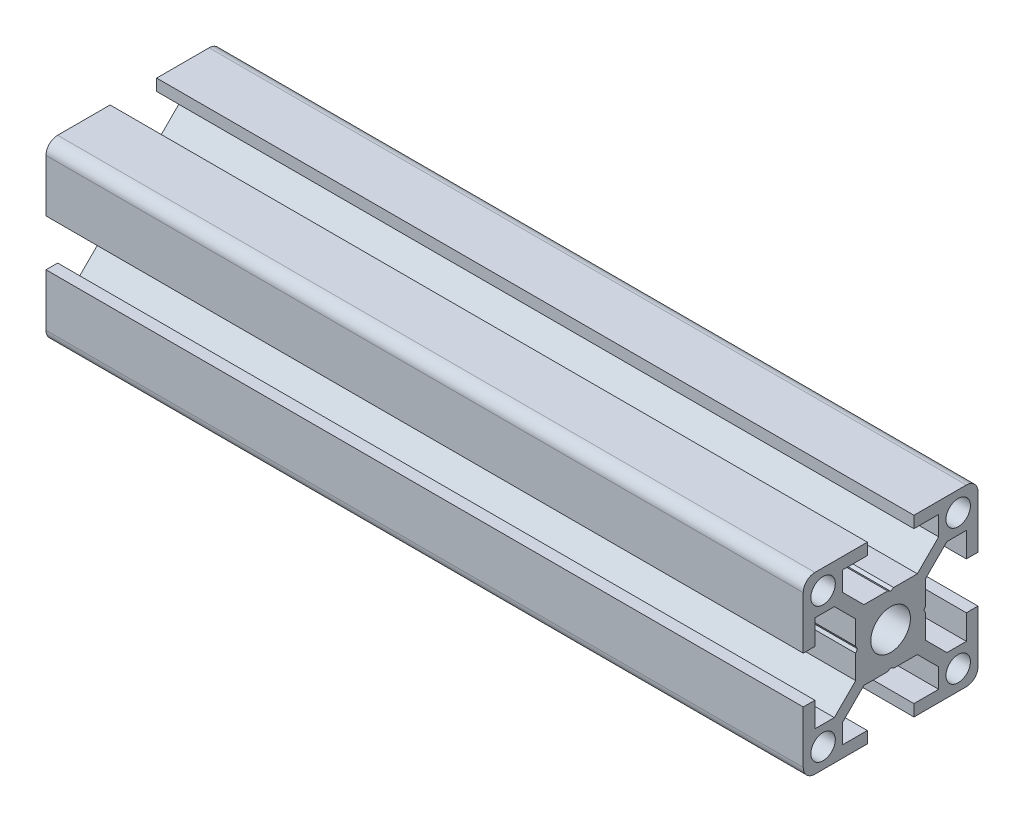
from build123d import *

# Parameters (mm, degrees)
SKETCH12_R              = 3.4
SKETCH12_R_2            = 2.1
NH_H_NH_30X30X2_1_DEPTH = 130


with BuildPart() as part:
    # Sketch12 → Ðnh hình 30X30X2(1) (new body)
    with BuildSketch(Plane.YZ):
        with BuildLine():
            Line((13, -4), (13, -8.25))
            Line((13, -8.25), (9.664213562, -8.25))
            Line((9.664213562, -8.25), (6, -4.585786438))
            Line((6, -4.585786438), (6, -0.519615242))
            Line((6, -0.519615242), (5.7, 0))
            Line((5.7, 0), (6, 0.519615242))
            Line((6, 0.519615242), (6, 4.585786438))
            Line((6, 4.585786438), (9.664213562, 8.25))
            Line((9.664213562, 8.25), (13, 8.25))
            Line((13, 8.25), (13, 4))
            Line((13, 4), (15, 4))
            Line((15, 4), (15, 13))
            ThreePointArc((15, 13), (14.414213562, 14.414213562), (13, 15))
            Line((13, 15), (4, 15))
            Line((4, 15), (4, 13))
            Line((4, 13), (8.25, 13))
            Line((8.25, 13), (8.25, 9.664213562))
            Line((8.25, 9.664213562), (4.585786438, 6))
            Line((4.585786438, 6), (0.519615242, 6))
            Line((0.519615242, 6), (0, 5.7))
            Line((0, 5.7), (-0.519615242, 6))
            Line((-0.519615242, 6), (-4.585786438, 6))
            Line((-4.585786438, 6), (-8.25, 9.664213562))
            Line((-8.25, 9.664213562), (-8.25, 13))
            Line((-8.25, 13), (-4, 13))
            Line((-4, 13), (-4, 15))
            Line((-4, 15), (-13, 15))
            ThreePointArc((-13, 15), (-14.414213562, 14.414213562), (-15, 13))
            Line((-15, 13), (-15, 4))
            Line((-15, 4), (-13, 4))
            Line((-13, 4), (-13, 8.25))
            Line((-13, 8.25), (-9.664213562, 8.25))
            Line((-9.664213562, 8.25), (-6, 4.585786438))
            Line((-6, 4.585786438), (-6, 0.519615242))
            Line((-6, 0.519615242), (-5.7, 0))
            Line((-5.7, 0), (-6, -0.519615242))
            Line((-6, -0.519615242), (-6, -4.585786438))
            Line((-6, -4.585786438), (-9.664213562, -8.25))
            Line((-9.664213562, -8.25), (-13, -8.25))
            Line((-13, -8.25), (-13, -4))
            Line((-13, -4), (-15, -4))
            Line((-15, -4), (-15, -13))
            ThreePointArc((-15, -13), (-14.414213562, -14.414213562), (-13, -15))
            Line((-13, -15), (-4, -15))
            Line((-4, -15), (-4, -13))
            Line((-4, -13), (-8.25, -13))
            Line((-8.25, -13), (-8.25, -9.664213562))
            Line((-8.25, -9.664213562), (-4.585786438, -6))
            Line((-4.585786438, -6), (-0.519615242, -6))
            Line((-0.519615242, -6), (0, -5.7))
            Line((0, -5.7), (0.519615242, -6))
            Line((0.519615242, -6), (4.585786438, -6))
            Line((4.585786438, -6), (8.25, -9.664213562))
            Line((8.25, -9.664213562), (8.25, -13))
            Line((8.25, -13), (4, -13))
            Line((4, -13), (4, -15))
            Line((4, -15), (13, -15))
            ThreePointArc((13, -15), (14.414213562, -14.414213562), (15, -13))
            Line((15, -13), (15, -4))
            Line((15, -4), (13, -4))
        make_face()
        Circle(SKETCH12_R, mode=Mode.SUBTRACT)
        with Locations((11.6, -11.6)):
            Circle(SKETCH12_R_2, mode=Mode.SUBTRACT)
        with Locations((11.6, 11.6)):
            Circle(SKETCH12_R_2, mode=Mode.SUBTRACT)
        with Locations((-11.6, 11.6)):
            Circle(SKETCH12_R_2, mode=Mode.SUBTRACT)
        with Locations((-11.6, -11.6)):
            Circle(SKETCH12_R_2, mode=Mode.SUBTRACT)
    extrude(amount=NH_H_NH_30X30X2_1_DEPTH)


solid = part.part
